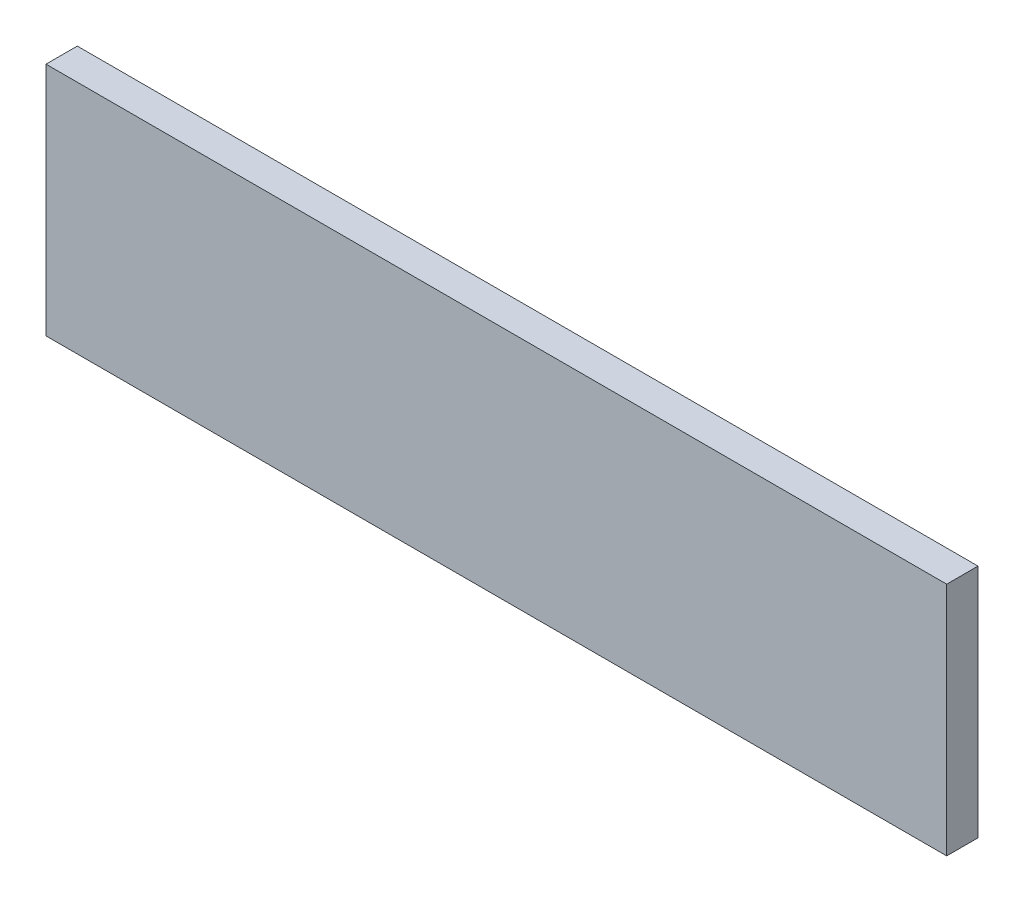
from build123d import *

# Parameters (mm, degrees)
SKETCH1_W           = 143.85
SKETCH1_H           = 37.59
BOSS_EXTRUDE1_DEPTH = 5


with BuildPart() as part:
    # Sketch1 → Boss-Extrude1 (new body)
    with BuildSketch(Plane.XY):
        with Locations((38.135081967, 2.670327869)):
            Rectangle(SKETCH1_W, SKETCH1_H)
    extrude(amount=BOSS_EXTRUDE1_DEPTH)


solid = part.part
